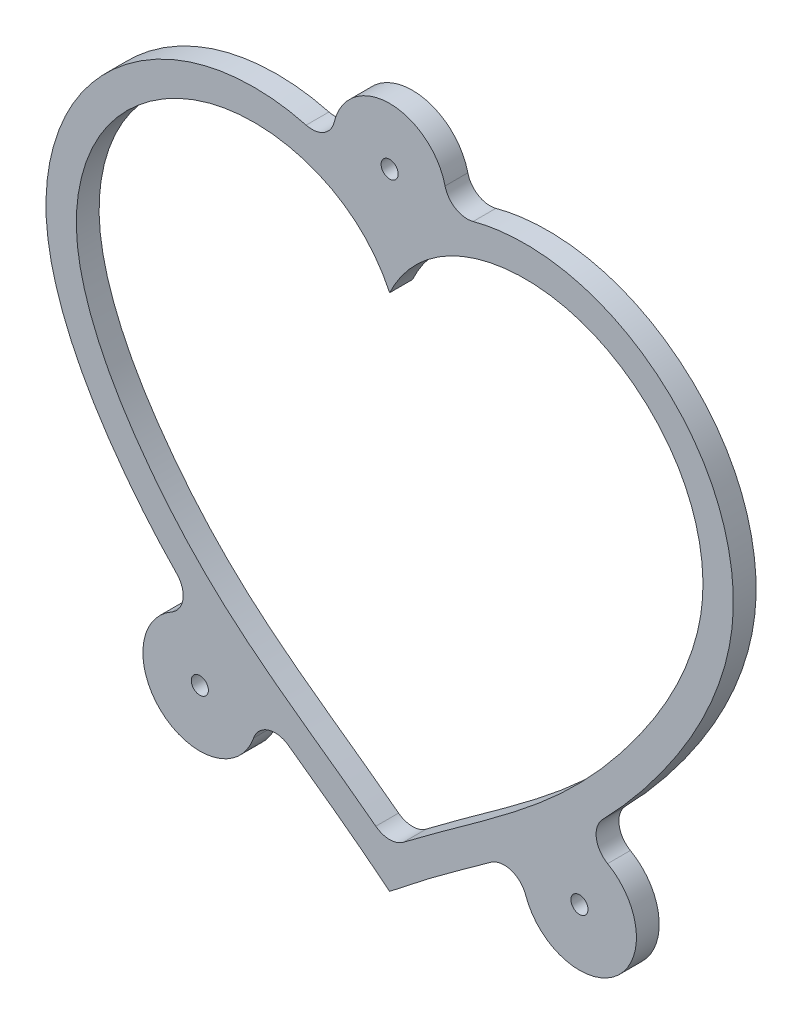
from build123d import *

# Parameters (mm, degrees)
BOSS_EXTRU_1_DEPTH = 6
ESQUISSE5_R        = 15
ESQUISSE5_R_2      = 2.25
BOSS_EXTRU_2_DEPTH = 6
CONG_1_R           = 6


with BuildPart() as part:
    # Esquisse4 → Boss.-Extru.1 (new body)
    with BuildSketch(Plane.XY):
        with BuildLine():
            add(Edge.make_bspline(
                [(82.472616095, -10.209400905), (81.473768233, -9.417456946), (79.980709865, -8.233833019), (77.969111672, -6.63849974), (76.02702582, -5.100393271), (73.579584991, -3.213319025), (69.587304059, -0.210302632), (64.491314394, 3.509119556), (56.180302528, 9.481838133), (45.653491001, 17.14469468), (35.326924258, 25.558682491), (27.502022229, 33.008783734), (20.085314738, 40.836407325), (13.270676045, 49.219363645), (7.085968127, 58.074252572), (2.770904447, 65.071966358), (-1.07084378, 72.455491772), (-4.31367616, 80.243721951), (-6.81075396, 88.562935857), (-8.195135533, 97.425235786), (-8.032438256, 106.596327776), (-6.330712291, 115.572236386), (-3.141408337, 124.198944653), (1.558030601, 132.199804754), (7.519100207, 139.212591542), (14.535168755, 145.163269137), (22.423138905, 149.916495524), (31.033243349, 153.34042103), (40.130468732, 155.238581256), (49.355880529, 155.582375027), (58.500420945, 154.36854218), (67.305388192, 151.550198602), (74.128909764, 147.801965869), (79.092575548, 143.947549858), (81.394634396, 141.713863229), (82.472616095, 140.542379671)],
                knots=[-0.025526634, -0.025526634, -0.025526634, -0.025526634, -0.010136609, -0.002441596, 0.005253416, 0.020643442, 0.036033467, 0.066813518, 0.097593568, 0.159153669, 0.220713771, 0.251493821, 0.282273872, 0.343833973, 0.374614024, 0.405394074, 0.436174125, 0.466954176, 0.497734226, 0.528514277, 0.559294327, 0.590074378, 0.620854429, 0.651634479, 0.68241453, 0.71319458, 0.743974631, 0.774754682, 0.805534732, 0.836314783, 0.867094834, 0.897874884, 0.928654935, 0.94404496, 0.959434985, 0.959434985, 0.959434985, 0.959434985], degree=3))
            add(Edge.make_bspline(
                [(82.472616095, 140.542379671), (83.550597794, 141.713863229), (85.852656642, 143.947549858), (90.816322426, 147.801965869), (97.639843998, 151.550198602), (106.444811245, 154.36854218), (115.589351662, 155.582375027), (124.814763458, 155.238581256), (133.911988842, 153.34042103), (142.522093285, 149.916495524), (150.410063436, 145.163269137), (157.426131984, 139.212591542), (163.387201589, 132.199804754), (168.086640528, 124.198944653), (171.275944481, 115.572236386), (172.977670446, 106.596327776), (173.140367724, 97.425235786), (171.755986151, 88.562935857), (169.25890835, 80.243721951), (166.01607597, 72.455491772), (162.174327743, 65.071966358), (157.859264063, 58.074252572), (151.674556145, 49.219363645), (144.859917452, 40.836407325), (137.443209961, 33.008783734), (129.618307932, 25.558682491), (119.291741189, 17.14469468), (108.764929662, 9.481838133), (100.453917796, 3.509119556), (95.357928131, -0.210302632), (91.3656472, -3.213319025), (88.91820637, -5.100393271), (86.976120518, -6.63849974), (84.964522325, -8.233833019), (83.471463957, -9.417456946), (82.472616095, -10.209400905)],
                knots=[-0.025526634, -0.025526634, -0.025526634, -0.025526634, -0.010136609, 0.005253416, 0.036033467, 0.066813518, 0.097593568, 0.128373619, 0.159153669, 0.18993372, 0.220713771, 0.251493821, 0.282273872, 0.313053922, 0.343833973, 0.374614024, 0.405394074, 0.436174125, 0.466954176, 0.497734226, 0.528514277, 0.559294327, 0.590074378, 0.651634479, 0.68241453, 0.71319458, 0.774754682, 0.836314783, 0.867094834, 0.897874884, 0.913264909, 0.928654935, 0.936349947, 0.94404496, 0.959434985, 0.959434985, 0.959434985, 0.959434985], degree=3))
        make_face()
        with BuildLine():
            add(Edge.make_bspline(
                [(82.472616095, 0), (97.001365121, 11.519226751), (122.36751101, 27.159664528), (147.664455446, 55.947352529), (160.776944752, 78.107581553), (166.836954822, 100.903984809), (160.564003733, 128.294665653), (126.577250321, 154.854375307), (91.066621187, 144.596317398), (82.472616095, 126.350308344)],
                knots=[0, 0, 0, 0, 0.223855728, 0.35428141, 0.457435149, 0.531451174, 0.633256174, 0.777210755, 1, 1, 1, 1], degree=3))
            add(Edge.make_bspline(
                [(82.472616095, 0), (67.943867069, 11.519226751), (42.57772118, 27.159664528), (17.280776744, 55.947352529), (4.168287438, 78.107581553), (-1.891722631, 100.903984809), (4.381228457, 128.294665653), (38.367981869, 154.854375307), (73.878611003, 144.596317398), (82.472616095, 126.350308344)],
                knots=[0, 0, 0, 0, 0.223855728, 0.35428141, 0.457435149, 0.531451174, 0.633256174, 0.777210755, 1, 1, 1, 1], degree=3))
        make_face(mode=Mode.SUBTRACT)
    extrude(amount=BOSS_EXTRU_1_DEPTH)

    # Esquisse5 → Boss.-Extru.2 (add)
    # profile 1 of 3: a face of its own
    with BuildSketch(Plane.XY.offset(6)):
        with Locations((32.472616095, 11.790599095)):
            Circle(ESQUISSE5_R)
        with Locations((32.472616095, 11.790599095)):
            Circle(ESQUISSE5_R_2, mode=Mode.SUBTRACT)
    # profile 2 of 3: a face of its own
    with BuildSketch(Plane.XY.offset(6)):
        with Locations((132.472616095, 11.790599095)):
            Circle(ESQUISSE5_R)
        with Locations(Location((132.472616095, 11.790599095, 0), (0, 0, 180))):
            Circle(ESQUISSE5_R_2, mode=Mode.SUBTRACT)
    # profile 3 of 3: a face of its own
    with BuildSketch(Plane.XY.offset(6)):
        with Locations((82.472616095, 154.542379671)):
            Circle(ESQUISSE5_R)
        with Locations((82.472616095, 154.542379671)):
            Circle(ESQUISSE5_R_2, mode=Mode.SUBTRACT)
    extrude(amount=-BOSS_EXTRU_2_DEPTH)

    # Congé1
    cong_1_edges = [part.edges().sort_by_distance(p)[0] for p in [
        (82.472616095, 0, 3),
        (67.906565982, 150.960455033, 3),
        (97.038666208, 150.960455033, 3),
        (118.236219943, 16.515535559, 3),
        (130.644527221, 26.678785387, 3),
        (34.300704969, 26.678785387, 3),
        (46.709012248, 16.515535559, 3),
    ]]
    fillet(cong_1_edges, radius=CONG_1_R)


solid = part.part
